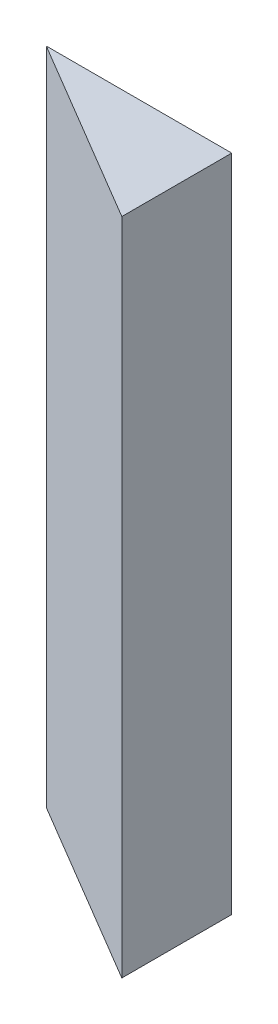
from build123d import *

# Parameters (mm, degrees)
BOSS_EXTRUDE1_DEPTH = 50.8


with BuildPart() as part:
    # Sketch1 → Boss-Extrude1 (new, symmetric)
    with BuildSketch(Plane(origin=(0, 0, 0), x_dir=(1, 0, 0), z_dir=(0, 1, 0))):
        Polygon((0, 0), (0, -16.933333333), (-28.575, 0), align=None)
    extrude(amount=BOSS_EXTRUDE1_DEPTH, both=True)


solid = part.part
